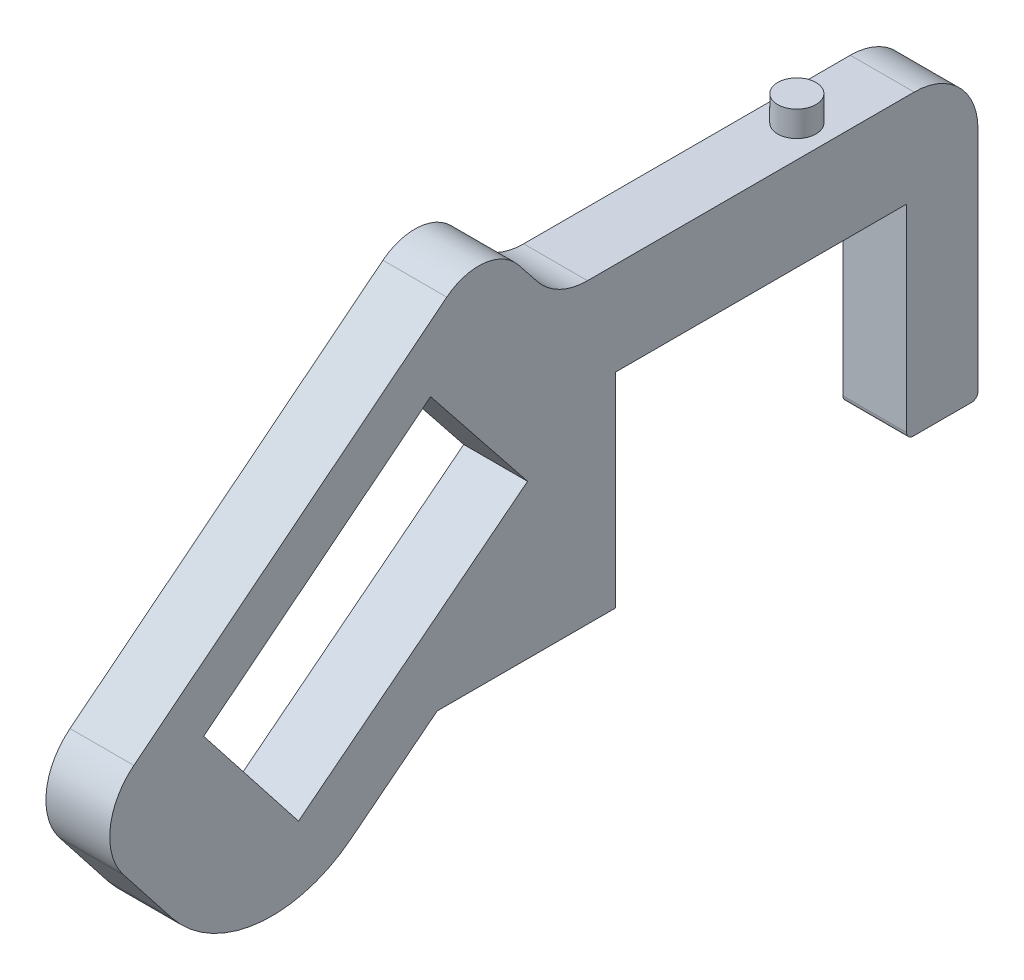
from build123d import *

# Parameters (mm, degrees)
RESSALTO_EXTRUS_O2_DEPTH = 5
ESBO_O2_R                = 1.5
RESSALTO_EXTRUS_O3_DEPTH = 2


with BuildPart() as part:
    # Esboço1 → Ressalto-extrusão2 (new body)
    with BuildSketch(Plane(origin=(0, 0, 0), x_dir=(0, 0, -1), z_dir=(1, 0, 0))):
        with BuildLine():
            Line((11.9, -8), (16.485851709, -8))
            ThreePointArc((16.485851709, -8), (16.8394051, -7.853553391), (16.985851709, -7.5))
            Line((16.985851709, -7.5), (16.985851709, 10.3))
            ThreePointArc((16.985851709, 10.3), (15.521385615, 13.835533906), (11.985851709, 15.3))
            Line((11.985851709, 15.3), (-13.596583919, 15.3))
            ThreePointArc((-13.596583919, 15.3), (-15.768192588, 15.796210952), (-17.508770855, 17.186353684))
            Line((-17.508770855, 17.186353684), (-18.996698023, 19.055881768))
            ThreePointArc((-18.996698023, 19.055881768), (-21.674724782, 20.539376184), (-24.617364625, 19.694714264))
            Line((-24.617364625, 19.694714264), (-49.125535856, 0.18905712))
            ThreePointArc((-49.125535856, 0.18905712), (-50.977914533, -3.141239982), (-49.945591755, -6.809549569))
            Line((-49.945591755, -6.809549569), (-46.177076689, -11.612595572))
            ThreePointArc((-46.177076689, -11.612595572), (-39.507910608, -15.367707761), (-32.136832755, -13.307160494))
            Line((-32.136832755, -13.307160494), (-25.372753124, -8))
            Line((-25.372753124, -8), (-11.4, -8))
            Line((-11.4, -8), (-11.4, 8))
            Line((-11.4, 8), (11.4, 8))
            Line((11.4, 8), (11.4, -7.5))
            ThreePointArc((11.4, -7.5), (11.546446609, -7.853553391), (11.9, -8))
        make_face()
        Polygon((-27.25904201, -3), (-18.290200962, 4.037037037), (-25.882056579, 13.575936242), (-43.655854678, -0.569942233), (-36.227883057, -10.037037037), align=None, mode=Mode.SUBTRACT)
    extrude(amount=RESSALTO_EXTRUS_O2_DEPTH)

    # Esboço2 → Ressalto-extrusão3 (add)
    with BuildSketch(Plane(origin=(0, 15.3, 0), x_dir=(1, 0, 0), z_dir=(0, 1, 0))):
        with Locations(Location((2.5, 5.295851709, 0), (0, 0, 90))):
            Circle(ESBO_O2_R)
    extrude(amount=RESSALTO_EXTRUS_O3_DEPTH)


solid = part.part
